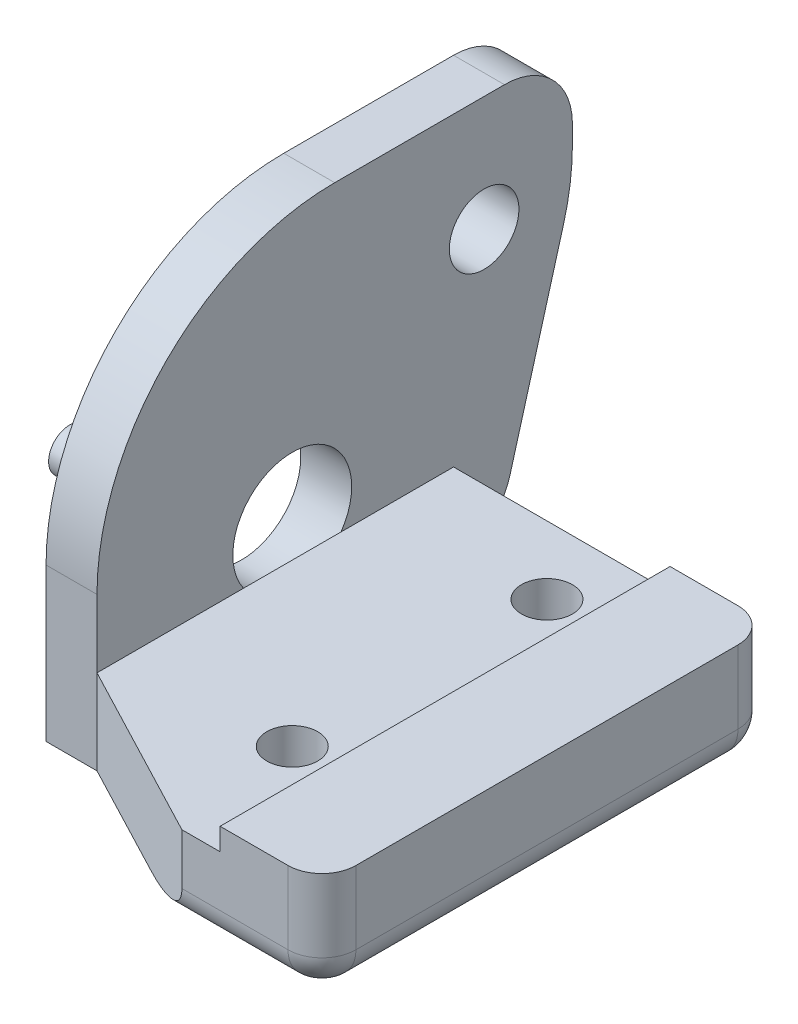
from build123d import *

# Parameters (mm, degrees)
EXTRUDE_1_DEPTH     = 5
SKETCH_2_W          = 28
SKETCH_2_H          = 23
EXTRUDE_2_DEPTH     = 3
SKETCH_3_R          = 1.5
CUT_EXTRUDE_1_DEPTH = 44.809958913
SKETCH_4_R          = 3.5
SKETCH_4_R_2        = 1.25
CUT_EXTRUDE_2_DEPTH = 43.400619099
FILLET_2_R          = 14
FILLET_3_R          = 2
SKETCH_6_W          = 6
SKETCH_6_H          = 26.5
EXTRUDE_3_DEPTH     = 1.3
FILLET_4_R          = 2
FILLET_5_R          = 2
SKETCH_7_R          = 1.25
EXTRUDE_5_DEPTH     = 6
EXTRUDE_6_DEPTH     = 3
SKETCH_11_R         = 2.05
CUT_EXTRUDE_3_DEPTH = 3
CUT_EXTRUDE_4_DEPTH = 3
FILLET_6_R          = 2
FILLET_7_R          = 2
FILLET_8_R          = 1
CUT_EXTRUDE_5_DEPTH = 10
FILLET_9_R          = 4


with BuildPart() as part:
    # 草图1 → 凸台-拉伸1 (new body)
    with BuildSketch(Plane(origin=(0, 0, 0), x_dir=(1, 0, 0), z_dir=(0, 1, 0))):
        Polygon((0, 0), (0, 26.5), (-18.75, 26.5), (-18.75, 5.5), (-8.25, 0), align=None)
    extrude(amount=-EXTRUDE_1_DEPTH)

    # 草图2 → 凸台-拉伸2 (add)
    with BuildSketch(Plane.ZY.offset(18.75)):
        with Locations((-19.5, 6.5)):
            Rectangle(SKETCH_2_W, SKETCH_2_H)
    extrude(amount=EXTRUDE_2_DEPTH)

    # 草图3 → 切除-拉伸1 (cut, through all)
    with BuildSketch(Plane(origin=(0, 0, 0), x_dir=(1, 0, 0), z_dir=(0, 1, 0))):
        with Locations(Location((-9.25, 22.5, 0), (0, 0, 270))):
            Circle(SKETCH_3_R)
        with Locations(Location((-9.25, 7.5, 0), (0, 0, 270))):
            Circle(SKETCH_3_R)
    extrude(amount=-CUT_EXTRUDE_1_DEPTH, mode=Mode.SUBTRACT)

    # 草图4 → 切除-拉伸2 (cut, through all)
    with BuildSketch(Plane(origin=(-18.75, 0, 0), x_dir=(0, 0, -1), z_dir=(1, 0, 0))):
        with Locations((17, 2)):
            Circle(SKETCH_4_R)
        with Locations((9.9, 6.2)):
            Circle(SKETCH_4_R_2)
    extrude(amount=-CUT_EXTRUDE_2_DEPTH, mode=Mode.SUBTRACT)

    # 圆角2
    fillet_2_edges = [part.edges().sort_by_distance(p)[0] for p in [
        (-20.25, 18, -5.5),
    ]]
    fillet(fillet_2_edges, radius=FILLET_2_R)

    # 圆角3
    fillet_3_edges = [part.edges().sort_by_distance(p)[0] for p in [
        (-9.375, -5, -26.5),
    ]]
    fillet(fillet_3_edges, radius=FILLET_3_R)

    # 草图6 → 凸台-拉伸3 (add)
    with BuildSketch(Plane(origin=(0, 0, 0), x_dir=(1, 0, 0), z_dir=(0, 1, 0))):
        with Locations((-3, 13.25)):
            Rectangle(SKETCH_6_W, SKETCH_6_H)
    extrude(amount=EXTRUDE_3_DEPTH)

    # 圆角4
    fillet_4_edges = [part.edges().sort_by_distance(p)[0] for p in [
        (0, -1.85, 0),
    ]]
    fillet(fillet_4_edges, radius=FILLET_4_R)

    # 圆角5
    fillet_5_edges = [part.edges().sort_by_distance(p)[0] for p in [
        (-5.125, -5, 0),
        (0, -0.85, -26.5),
        (0, -4.414213562, -25.914213562),
        (0, -5, -13.25),
        (-0.585786438, -5, -0.585786438),
    ]]
    fillet(fillet_5_edges, radius=FILLET_5_R)

    # 草图7 → 凸台-拉伸5 (add)
    with BuildSketch(Plane(origin=(-18.75, 0, 0), x_dir=(0, 0, -1), z_dir=(1, 0, 0))):
        with Locations((9.9, 6.2)):
            Circle(SKETCH_7_R)
    extrude(amount=-EXTRUDE_5_DEPTH)

    # 草图9 → 凸台-拉伸6 (add)
    with BuildSketch(Plane(origin=(-18.75, 0, 0), x_dir=(0, 0, -1), z_dir=(1, 0, 0))):
        Polygon((28.3, 21.2), (33.5, 21.2), (33.5, 18), (22.5, 18), (22.5, 21.2), align=None)
    extrude(amount=-EXTRUDE_6_DEPTH)

    # 草图11 → 切除-拉伸3 (cut)
    with BuildSketch(Plane(origin=(-18.75, 0, 0), x_dir=(0, 0, -1), z_dir=(1, 0, 0))):
        with Locations((28.3, 11.22875654)):
            Circle(SKETCH_11_R)
    extrude(amount=-CUT_EXTRUDE_3_DEPTH, mode=Mode.SUBTRACT)

    # 草图5 → 切除-拉伸4 (cut)
    with BuildSketch(Plane(origin=(-18.75, 0, 0), x_dir=(0, 0, -1), z_dir=(1, 0, 0))):
        with BuildLine():
            Line((32.977113162, 9.140846799), (29.820411226, -2.082982308))
            ThreePointArc((29.820411226, -2.082982308), (28.385182257, -4.188410986), (25.969807465, -5))
            Line((25.969807465, -5), (33.5, -5))
            Line((33.5, -5), (33.5, 12.931284876))
            ThreePointArc((33.5, 12.931284876), (33.368662233, 11.018117903), (32.977113162, 9.140846799))
        make_face()
    extrude(amount=-CUT_EXTRUDE_4_DEPTH, mode=Mode.SUBTRACT)

    # 圆角6
    fillet_6_edges = [part.edges().sort_by_distance(p)[0] for p in [
        (-20.25, 21.2, -22.5),
    ]]
    fillet(fillet_6_edges, radius=FILLET_6_R)

    # 圆角7
    fillet_7_edges = [part.edges().sort_by_distance(p)[0] for p in [
        (-20.25, 21.2, -33.5),
    ]]
    fillet(fillet_7_edges, radius=FILLET_7_R)

    # 圆角8
    fillet_8_edges = [part.edges().sort_by_distance(p)[0] for p in [
        (-20.25, 18, -22.5),
    ]]
    fillet(fillet_8_edges, radius=FILLET_8_R)

    # 草图12 → 切除-拉伸5 (cut)
    with BuildSketch(Plane(origin=(-18.75, 0, 0), x_dir=(0, 0, -1), z_dir=(1, 0, 0))):
        Polygon((21.5, 18), (33.5, 18), (35.180339048, 22.165519881), (18.832388957, 21.830422807), align=None)
    extrude(amount=-CUT_EXTRUDE_5_DEPTH, mode=Mode.SUBTRACT)

    # 圆角9
    fillet_9_edges = [part.edges().sort_by_distance(p)[0] for p in [
        (-20.25, 18, -33.5),
    ]]
    fillet(fillet_9_edges, radius=FILLET_9_R)


solid = part.part
